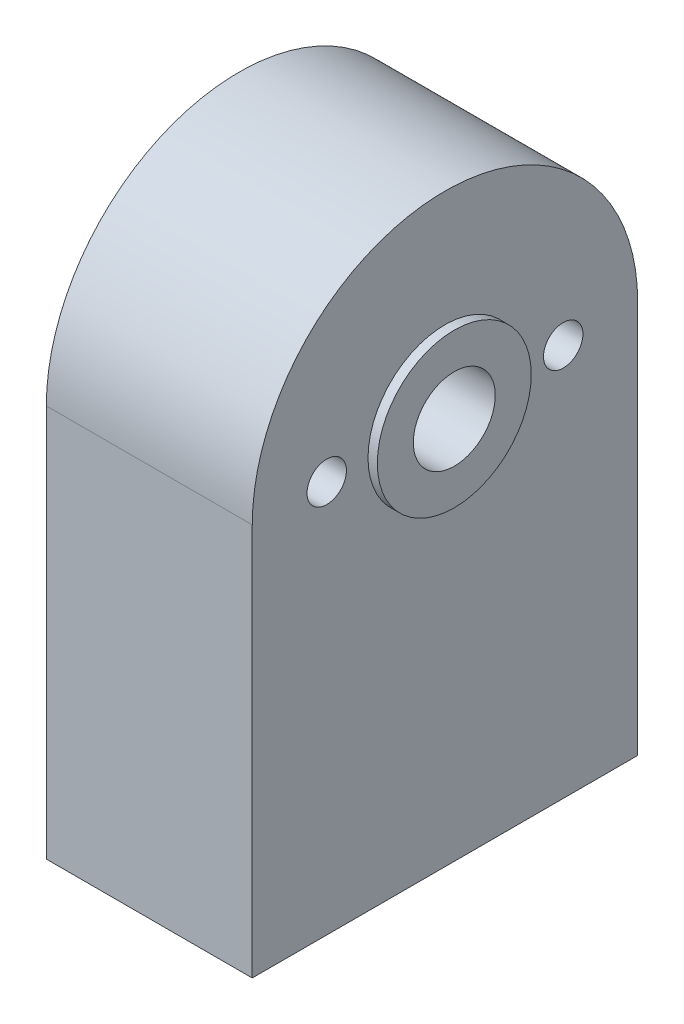
from build123d import *

# Parameters (mm, degrees)
BOSS_EXTRUDE1_DEPTH = 16.59
SKETCH2_R           = 6.2
BOSS_EXTRUDE2_DEPTH = 0.75
SKETCH3_R           = 3.3
SKETCH3_R_2         = 1.5875
CUT_EXTRUDE1_DEPTH  = 40.258240536


with BuildPart() as part:
    # Sketch1 → Boss-Extrude1 (new body)
    with BuildSketch(Plane(origin=(0, 0, 0), x_dir=(0, 0, -1), z_dir=(1, 0, 0))):
        with BuildLine():
            Line((-15.525, -31.615), (15.525, -31.615))
            Line((15.525, -31.615), (15.525, 0))
            ThreePointArc((15.525, 0), (0, 15.525), (-15.525, 0))
            Line((-15.525, 0), (-15.525, -31.615))
        make_face()
    extrude(amount=BOSS_EXTRUDE1_DEPTH)

    # Sketch2 → Boss-Extrude2 (add)
    with BuildSketch(Plane(origin=(16.59, 0, 0), x_dir=(0, 0, -1), z_dir=(1, 0, 0))):
        with Locations(Location((0, 0, 0), (0, 0, 180))):
            Circle(SKETCH2_R)
    extrude(amount=BOSS_EXTRUDE2_DEPTH)

    # Sketch3 → Cut-Extrude1 (cut, through all)
    with BuildSketch(Plane(origin=(17.34, 0, 0), x_dir=(0, 0, -1), z_dir=(1, 0, 0))):
        Circle(SKETCH3_R)
        with Locations((-9.525, 0)):
            Circle(SKETCH3_R_2)
        with Locations((9.525, 0)):
            Circle(SKETCH3_R_2)
    extrude(amount=-CUT_EXTRUDE1_DEPTH, mode=Mode.SUBTRACT)


solid = part.part
